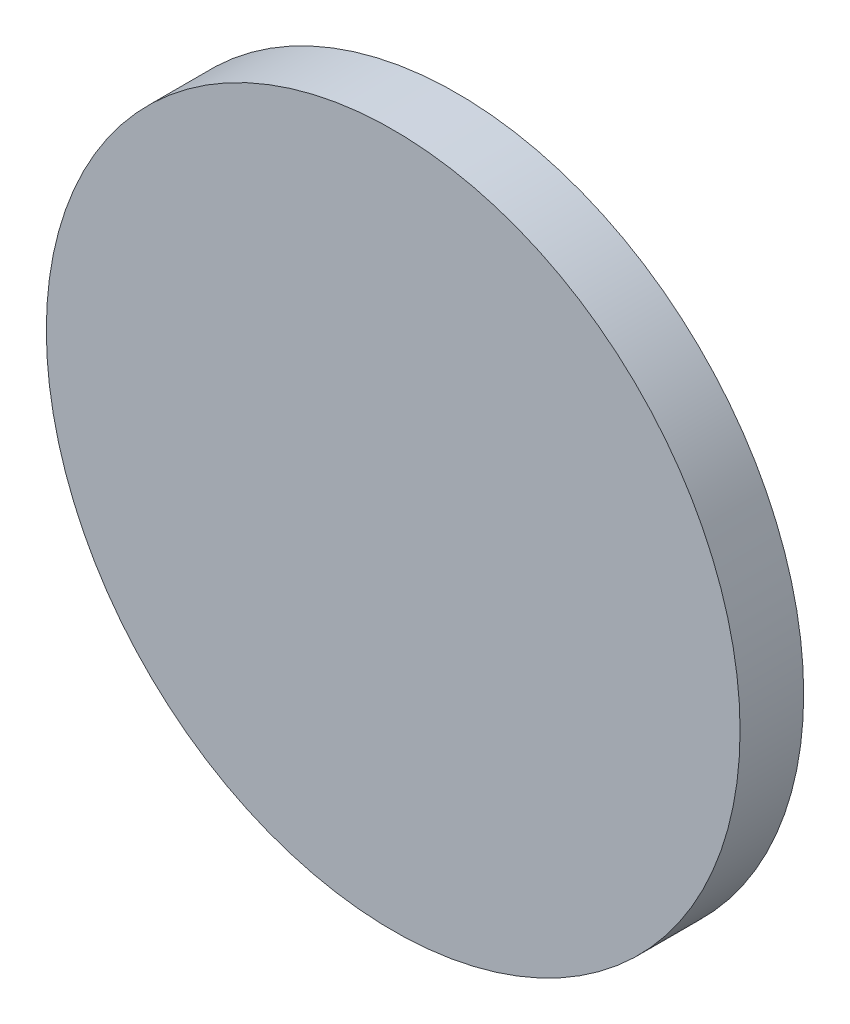
from build123d import *

# Parameters (mm, degrees)
ESQUISSE1_R             = 30
BOSS_EXTRU_1_DEPTH      = 5.5
ESQUISSE2_R             = 2.5
ENL_V_MAT_EXTRU_1_DEPTH = 2


with BuildPart() as part:
    # Esquisse1 → Boss.-Extru.1 (new body)
    with BuildSketch(Plane.XY):
        Circle(ESQUISSE1_R)
    extrude(amount=BOSS_EXTRU_1_DEPTH)

    # Esquisse2 → Enlèv. mat.-Extru.1 (cut)
    with BuildSketch(Plane(origin=(0, 0, 0), x_dir=(-1, 0, 0), z_dir=(0, 0, -1))):
        Circle(ESQUISSE2_R)
    extrude(amount=-ENL_V_MAT_EXTRU_1_DEPTH, mode=Mode.SUBTRACT)


solid = part.part
